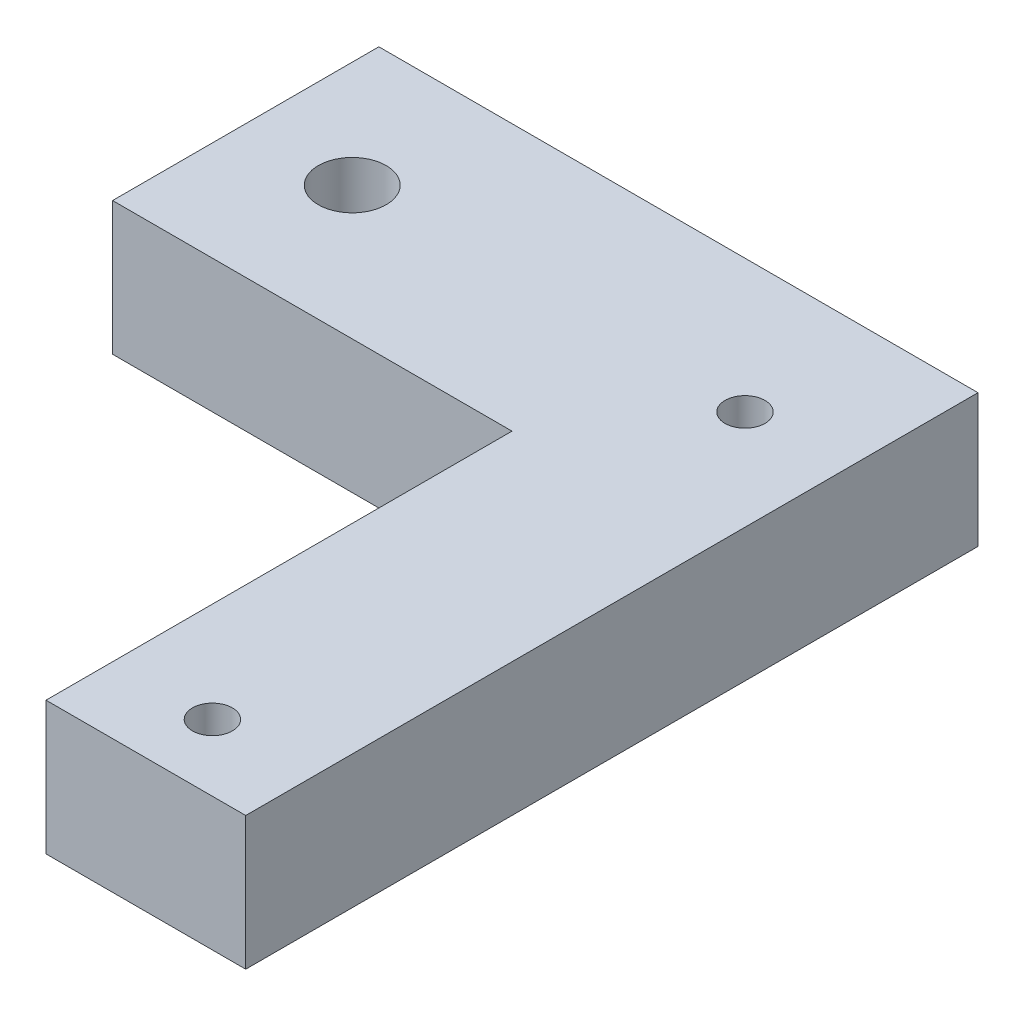
from build123d import *

# Parameters (mm, degrees)
SKETCH1_W           = 15
SKETCH1_H           = 55
SKETCH1_R           = 1.5
SKETCH1_W_2         = 30
SKETCH1_H_2         = 20
SKETCH1_R_2         = 2.55
BOSS_EXTRUDE1_DEPTH = 10


with BuildPart() as part:
    # Sketch1 → Boss-Extrude1 (new body)
    # profile 1 of 2: a face of its own
    with BuildSketch(Plane(origin=(0, 0, 0), x_dir=(1, 0, 0), z_dir=(0, 1, 0))):
        Rectangle(SKETCH1_W, SKETCH1_H)
        with Locations(Location((0, -22.5, 0), (0, 0, 270))):
            Circle(SKETCH1_R, mode=Mode.SUBTRACT)
        with Locations(Location((0, 17.5, 0), (0, 0, 270))):
            Circle(SKETCH1_R, mode=Mode.SUBTRACT)
    # profile 2 of 2: a face of its own
    with BuildSketch(Plane(origin=(0, 0, 0), x_dir=(1, 0, 0), z_dir=(0, 1, 0))):
        with Locations((-22.5, 17.5)):
            Rectangle(SKETCH1_W_2, SKETCH1_H_2)
        with Locations(Location((-29.5, 17.5, 0), (0, 0, 270))):
            Circle(SKETCH1_R_2, mode=Mode.SUBTRACT)
    extrude(amount=BOSS_EXTRUDE1_DEPTH)


solid = part.part
